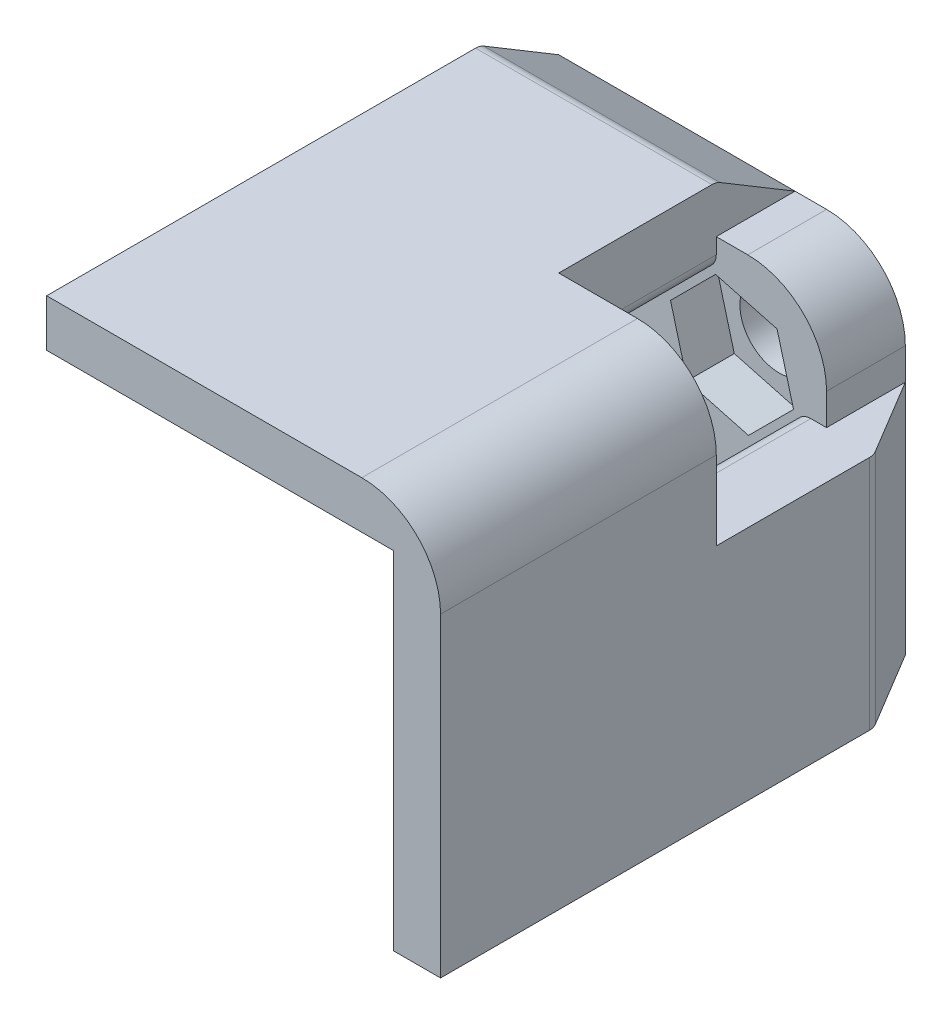
from build123d import *

# Parameters (mm, degrees)
BOSS_EXTRU_4_DEPTH       = 25
BOSS_EXTRU_5_DEPTH       = 2.5
BOSS_EXTRU_6_DEPTH       = 5
ESQUISSE8_W              = 10
ESQUISSE8_H              = 10
ENL_V_MAT_EXTRU_3_DEPTH  = 10
ENL_V_START              = -25
ESQUISSE14_W             = 5
ESQUISSE14_H             = 3
ENL_V_MAT_EXTRU_13_DEPTH = 25
ENL_V_START_2            = -22
ESQUISSE15_W             = 3
ESQUISSE15_H             = 5
ENL_V_MAT_EXTRU_14_DEPTH = 22
BOSS_EXTRU_8_START       = -15
BOSS_EXTRU_8_DEPTH       = 15
BOSS_EXTRU_9_DEPTH       = 15
CONG_16_R                = 5
ESQUISSE20_R             = 2.5
ENL_V_MAT_EXTRU_16_DEPTH = 2
ENL_V_MAT_EXTRU_17_DEPTH = 3
CONG_31_R                = 1
CONG_37_R                = 1


with BuildPart() as part:
    # Esquisse1 → Boss.-Extru.4 (new body)
    with BuildSketch(Plane.XY):
        Polygon((-11.012370079, 11.844262295), (13.987629921, 11.844262295), (13.987629921, -13.155737705), (8.987629921, -13.155737705), (8.987629921, 6.844262295), (-11.012370079, 6.844262295), align=None)
    extrude(amount=BOSS_EXTRU_4_DEPTH)

    # Esquisse6 → Boss.-Extru.5 (add)
    with BuildSketch(Plane.XY.offset(25)):
        Polygon((10.987629921, -13.155737705), (13.987629921, -13.155737705), (13.987629921, 11.844262295), (-11.012370079, 11.844262295), (-11.012370079, 8.844262295), (10.987629921, 8.844262295), align=None)
    extrude(amount=BOSS_EXTRU_5_DEPTH)

    # Esquisse7 → Boss.-Extru.6 (add)
    with BuildSketch(Plane(origin=(0, 0, 0), x_dir=(-1, 0, 0), z_dir=(0, 0, -1))):
        Polygon((11.012370079, 6.844262295), (-8.987629921, -13.155737705), (-13.987629921, -13.155737705), (-13.987629921, 11.844262295), (11.012370079, 11.844262295), align=None)
    extrude(amount=BOSS_EXTRU_6_DEPTH)

    # Esquisse8 → Enlèv. mat.-Extru.3 (cut)
    with BuildSketch(Plane(origin=(13.987629921, 0, 0), x_dir=(0, 0, -1), z_dir=(1, 0, 0))):
        with Locations((-5, 6.844262295)):
            Rectangle(ESQUISSE8_W, ESQUISSE8_H)
    extrude(amount=-ENL_V_MAT_EXTRU_3_DEPTH, mode=Mode.SUBTRACT)

    # Esquisse14 → Enlèv. mat.-Extru.13 (cut)
    with BuildSketch(Plane.ZY.offset(11.012370079).offset(ENL_V_START)):
        with Locations((-2.5, 10.344262295)):
            Rectangle(ESQUISSE14_W, ESQUISSE14_H)
    extrude(amount=ENL_V_MAT_EXTRU_13_DEPTH, mode=Mode.SUBTRACT)

    # Esquisse15 → Enlèv. mat.-Extru.14 (cut)
    with BuildSketch(Plane(origin=(0, -13.155737705, 0), x_dir=(-1, 0, 0), z_dir=(0, -1, 0)).offset(ENL_V_START_2)):
        with Locations((-12.487629921, 2.5)):
            Rectangle(ESQUISSE15_W, ESQUISSE15_H)
    extrude(amount=ENL_V_MAT_EXTRU_14_DEPTH, mode=Mode.SUBTRACT)

    # Esquisse16 → Boss.-Extru.8 (add)
    with BuildSketch(Plane(origin=(0, -13.155737705, 0), x_dir=(-1, 0, 0), z_dir=(0, -1, 0)).offset(BOSS_EXTRU_8_START)):
        Polygon((-10.987629921, 0), (-13.987629921, 0), (-10.987629921, 5), align=None)
    extrude(amount=BOSS_EXTRU_8_DEPTH)

    # Esquisse17 → Boss.-Extru.9 (add)
    with BuildSketch(Plane.ZY.offset(11.012370079)):
        Polygon((-5, 8.844262295), (0, 11.844262295), (0, 8.844262295), align=None)
    extrude(amount=-BOSS_EXTRU_9_DEPTH)

    # Congé16
    cong_16_edges = [part.edges().sort_by_distance(p)[0] for p in [
        (13.987629921, 11.844262295, 18.75),
        (10.987629921, 8.844262295, -2.5),
    ]]
    fillet(cong_16_edges, radius=CONG_16_R)

    # Esquisse20 → Enlèv. mat.-Extru.16 (cut)
    with BuildSketch(Plane.XY.offset(-3)):
        with Locations((4.987629921, 2.844262295)):
            Circle(ESQUISSE20_R)
    extrude(amount=-ENL_V_MAT_EXTRU_16_DEPTH, mode=Mode.SUBTRACT)

    # Esquisse18 → Enlèv. mat.-Extru.17 (cut)
    with BuildSketch(Plane.XY):
        Polygon((2.129891888, -0.013475738), (6.033634639, -1.059480456), (8.891372672, 1.798257578), (7.845367954, 5.702000328), (3.941625204, 6.748005046), (1.08388717, 3.890267013), align=None)
    extrude(amount=-ENL_V_MAT_EXTRU_17_DEPTH, mode=Mode.SUBTRACT)

    # Congé31
    cong_31_edges = [part.edges().sort_by_distance(p)[0] for p in [
        (8.987629921, 1.844262295, 5),
        (3.987629921, 6.844262295, 5),
    ]]
    fillet(cong_31_edges, radius=CONG_31_R)

    # Congé37
    cong_37_edges = [part.edges().sort_by_distance(p)[0] for p in [
        (-3.512370079, 11.844262295, 0),
        (13.987629921, -5.655737705, 0),
    ]]
    fillet(cong_37_edges, radius=CONG_37_R)


solid = part.part
